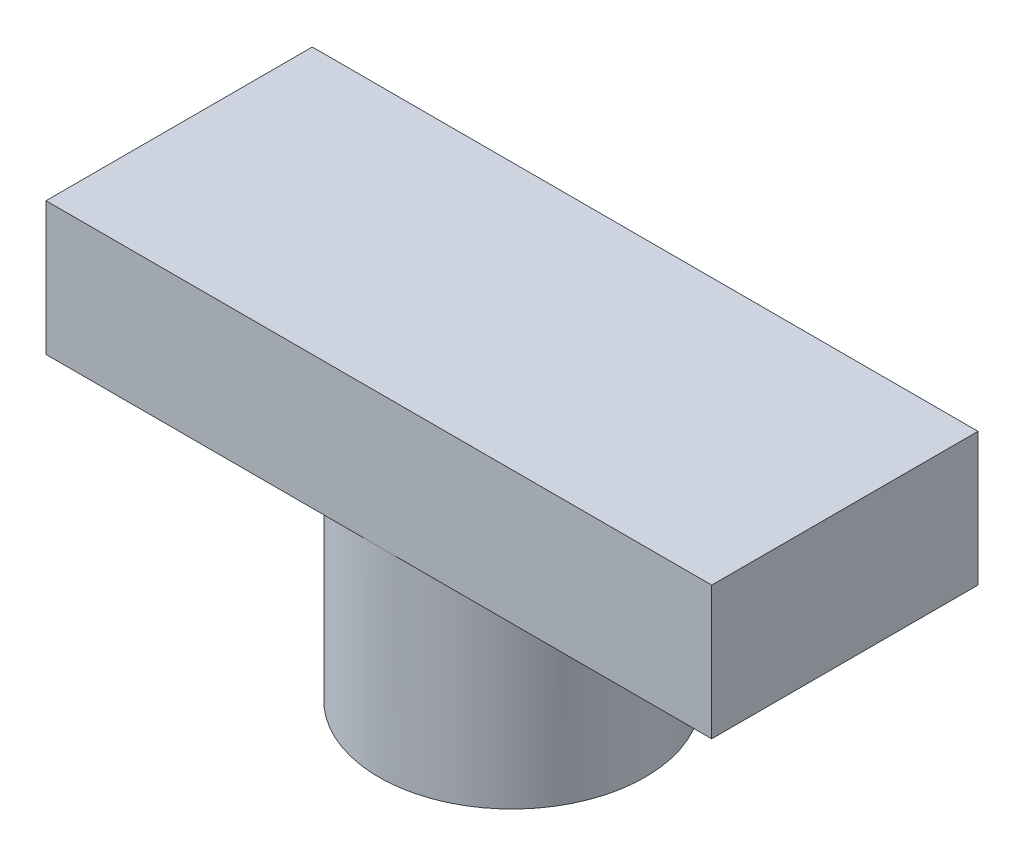
from build123d import *

# Parameters (mm, degrees)
SKETCH2_W           = 10
SKETCH2_H           = 4
BOSS_EXTRUDE2_DEPTH = 2
SKETCH3_R           = 2
BOSS_EXTRUDE3_DEPTH = 3


with BuildPart() as part:
    # Sketch2 → Boss-Extrude2 (new body)
    with BuildSketch(Plane(origin=(0, 0, 0), x_dir=(1, 0, 0), z_dir=(0, 1, 0))):
        with Locations((5, 2)):
            Rectangle(SKETCH2_W, SKETCH2_H)
    extrude(amount=BOSS_EXTRUDE2_DEPTH)

    # Sketch3 → Boss-Extrude3 (add)
    with BuildSketch(Plane.XZ):
        with Locations(Location((5, -2, 0), (0, 0, 270))):
            Circle(SKETCH3_R)
    extrude(amount=BOSS_EXTRUDE3_DEPTH)


solid = part.part
